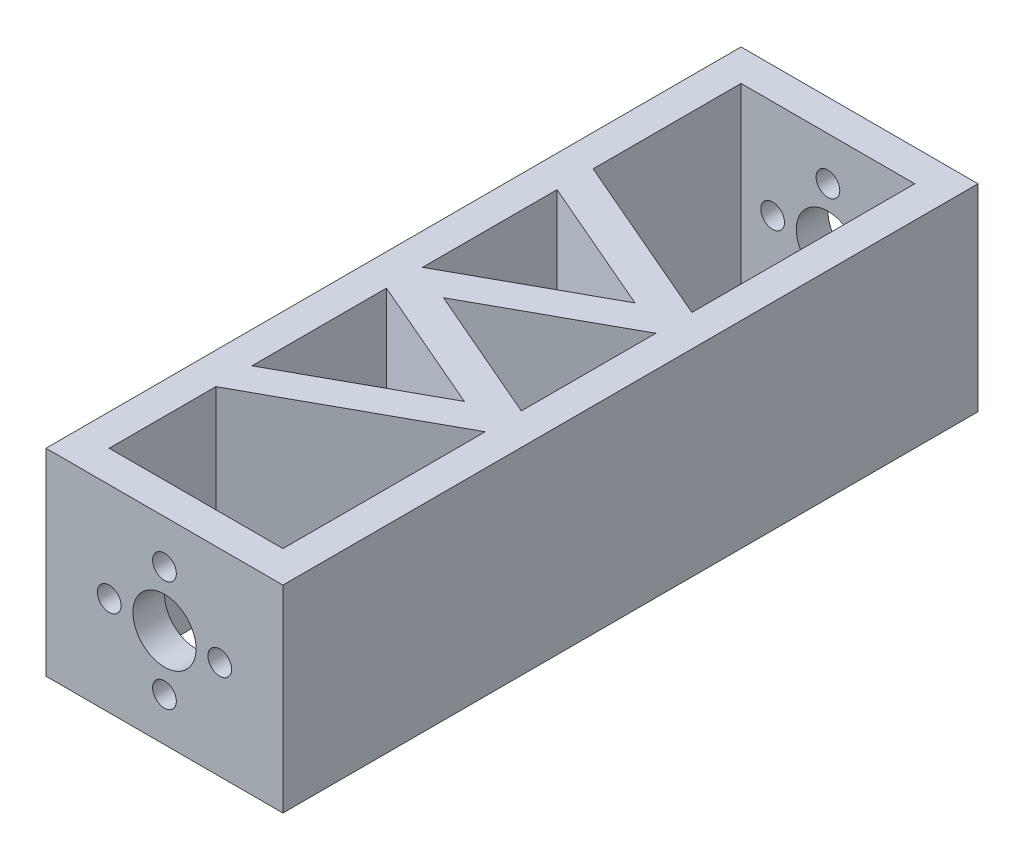
from build123d import *

# Parameters (mm, degrees)
SKETCH_1_W          = 30
SKETCH_1_H          = 25
SKETCH_1_R          = 1.5
SKETCH_1_R_2        = 4
EXTRUDE_1_DEPTH     = 4
SKETCH_2_W          = 4
SKETCH_2_H          = 25
EXTRUDE_2_DEPTH     = 80
SKETCH_3_W          = 30
SKETCH_3_H          = 25
EXTRUDE_3_DEPTH     = 4
CUT_EXTRUDE_START   = -11
SKETCH_4_R          = 1.5
SKETCH_4_R_2        = 4
CUT_EXTRUDE_1_DEPTH = 11
EXTRUDE_4_DEPTH     = 25


with BuildPart() as part:
    # 草图1 → 凸台-拉伸1 (new body)
    with BuildSketch(Plane.XY):
        Rectangle(SKETCH_1_W, SKETCH_1_H)
        with Locations((7, 0)):
            Circle(SKETCH_1_R, mode=Mode.SUBTRACT)
        with Locations((0, 7)):
            Circle(SKETCH_1_R, mode=Mode.SUBTRACT)
        with Locations((-7, 0)):
            Circle(SKETCH_1_R, mode=Mode.SUBTRACT)
        with Locations((0, -7)):
            Circle(SKETCH_1_R, mode=Mode.SUBTRACT)
        Circle(SKETCH_1_R_2, mode=Mode.SUBTRACT)
    extrude(amount=EXTRUDE_1_DEPTH)

    # 草图2 → 凸台-拉伸2 (add)
    with BuildSketch(Plane.XY.offset(4)):
        with Locations((-13, 0)):
            Rectangle(SKETCH_2_W, SKETCH_2_H)
        with Locations((13, 0)):
            Rectangle(SKETCH_2_W, SKETCH_2_H)
    extrude(amount=EXTRUDE_2_DEPTH)

    # 草图3 → 凸台-拉伸3 (add)
    with BuildSketch(Plane.XY.offset(84)):
        Rectangle(SKETCH_3_W, SKETCH_3_H)
    extrude(amount=EXTRUDE_3_DEPTH)

    # 草图4 → 切除-拉伸1 (cut)
    with BuildSketch(Plane.XY.offset(88).offset(CUT_EXTRUDE_START)):
        with Locations((-7, 0)):
            Circle(SKETCH_4_R)
        with Locations((0, -7)):
            Circle(SKETCH_4_R)
        with Locations((7, 0)):
            Circle(SKETCH_4_R)
        Circle(SKETCH_4_R_2)
        with Locations((0, 7)):
            Circle(SKETCH_4_R)
    extrude(amount=CUT_EXTRUDE_1_DEPTH, mode=Mode.SUBTRACT)

    # 草图9 → 凸台-拉伸4 (add)
    with BuildSketch(Plane.XZ.offset(12.5)):
        Polygon((11, 58.385569275), (-11, 70.493433903), (-11, 65.927659735), (6.349452589, 56.379258675), align=None)
        Polygon((11, 53.819795107), (11, 58.385569275), (6.349452589, 56.379258675), align=None)
        Polygon((-6.349452589, 46.335000836), (11, 53.819795107), (6.349452589, 56.379258675), (-11, 48.894464404), align=None)
        Polygon((-6.349452589, 46.335000836), (-11, 48.894464404), (-11, 44.328690237), align=None)
        Polygon((11, 36.786599776), (-6.349452589, 46.335000836), (-11, 44.328690237), (6.349452589, 34.780289177), align=None)
        Polygon((11, 32.220825609), (11, 36.786599776), (6.349452589, 34.780289177), align=None)
        Polygon((-11, 22.729720739), (11, 32.220825609), (6.349452589, 34.780289177), (-11, 27.295494906), align=None)
    extrude(amount=-EXTRUDE_4_DEPTH)


solid = part.part
